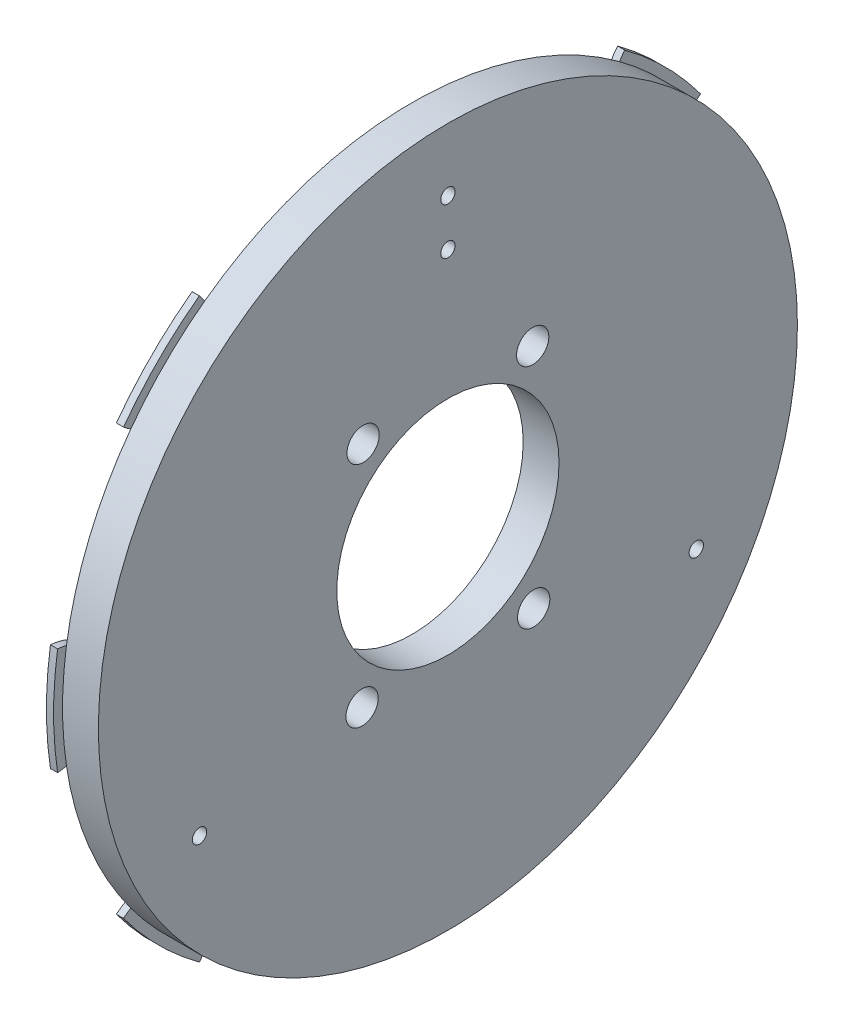
from build123d import *

# Parameters (mm, degrees)
BOSS_EXTRUDE1_START = 2
SKETCH1_R           = 97.5
SKETCH1_R_2         = 31
SKETCH1_R_3         = 4.5
SKETCH1_R_4         = 2
BOSS_EXTRUDE1_DEPTH = 10
BOSS_EXTRUDE2_DEPTH = 2
SKETCH7_R           = 2
CUT_EXTRUDE1_DEPTH  = 10
SKETCH8_R           = 5
BOSS_EXTRUDE3_DEPTH = 12.5


with BuildPart() as part:
    # Sketch1 → Boss-Extrude1 (new body)
    with BuildSketch(Plane(origin=(0, 0, 0), x_dir=(0, 0, -1), z_dir=(1, 0, 0)).offset(BOSS_EXTRUDE1_START)):
        Circle(SKETCH1_R)
        Circle(SKETCH1_R_2, mode=Mode.SUBTRACT)
        with Locations((23.65, 31.8556608)):
            Circle(SKETCH1_R_3, mode=Mode.SUBTRACT)
        with Locations((23.932849605, -31.643709245)):
            Circle(SKETCH1_R_3, mode=Mode.SUBTRACT)
        with Locations((-23.932849605, -31.643709245)):
            Circle(SKETCH1_R_3, mode=Mode.SUBTRACT)
        with Locations((-23.65, 31.8556608)):
            Circle(SKETCH1_R_3, mode=Mode.SUBTRACT)
        with Locations((0, 80)):
            Circle(SKETCH1_R_4, mode=Mode.SUBTRACT)
        with Locations((69.282032303, -40)):
            Circle(SKETCH1_R_4, mode=Mode.SUBTRACT)
        with Locations((-69.282032303, -40)):
            Circle(SKETCH1_R_4, mode=Mode.SUBTRACT)
    extrude(amount=BOSS_EXTRUDE1_DEPTH)

    # Sketch6 → Boss-Extrude2 (add)
    with BuildSketch(Plane.ZY.offset(-2)):
        with BuildLine():
            ThreePointArc((80.491911572, 59.338454408), (70.710678119, 70.710678119), (59.338454408, 80.491911572))
            ThreePointArc((59.338454408, 80.491911572), (60.104076401, 60.104076401), (80.491911572, 59.338454408))
        make_face()
        with BuildLine():
            ThreePointArc((98.875, 14.957753006), (85, 0), (98.875, -14.957753006))
            ThreePointArc((98.875, -14.957753006), (100, 0), (98.875, 14.957753006))
        make_face()
        with BuildLine():
            ThreePointArc((80.491911572, -59.338454408), (60.104076401, -60.104076401), (59.338454408, -80.491911572))
            ThreePointArc((59.338454408, -80.491911572), (70.710678119, -70.710678119), (80.491911572, -59.338454408))
        make_face()
        with BuildLine():
            ThreePointArc((-59.338454408, -80.491911572), (-60.104076401, -60.104076401), (-80.491911572, -59.338454408))
            ThreePointArc((-80.491911572, -59.338454408), (-70.710678119, -70.710678119), (-59.338454408, -80.491911572))
        make_face()
        with BuildLine():
            ThreePointArc((-98.875, -14.957753006), (-85, 0), (-98.875, 14.957753006))
            ThreePointArc((-98.875, 14.957753006), (-100, 0), (-98.875, -14.957753006))
        make_face()
        with BuildLine():
            ThreePointArc((-80.491911572, 59.338454408), (-60.104076401, 60.104076401), (-59.338454408, 80.491911572))
            ThreePointArc((-59.338454408, 80.491911572), (-70.710678119, 70.710678119), (-80.491911572, 59.338454408))
        make_face()
    extrude(amount=BOSS_EXTRUDE2_DEPTH)

    # Sketch7 → Cut-Extrude1 (cut)
    with BuildSketch(Plane.ZY.offset(-2)):
        with Locations((0, 67)):
            Circle(SKETCH7_R)
    extrude(amount=-CUT_EXTRUDE1_DEPTH, mode=Mode.SUBTRACT)

    # Sketch8 → Boss-Extrude3 (add, symmetric)
    with BuildSketch(Plane.XY):
        with BuildLine():
            Line((-21, -60.5), (3.212451129, -60.5))
            Line((3.212451129, -60.5), (3.212451129, -71.5))
            Line((3.212451129, -71.5), (-21, -71.5))
            ThreePointArc((-21, -71.5), (-26.5, -66), (-21, -60.5))
        make_face()
        with Locations((-21, -66)):
            Circle(SKETCH8_R, mode=Mode.SUBTRACT)
    extrude(amount=BOSS_EXTRUDE3_DEPTH, both=True)


solid = part.part
